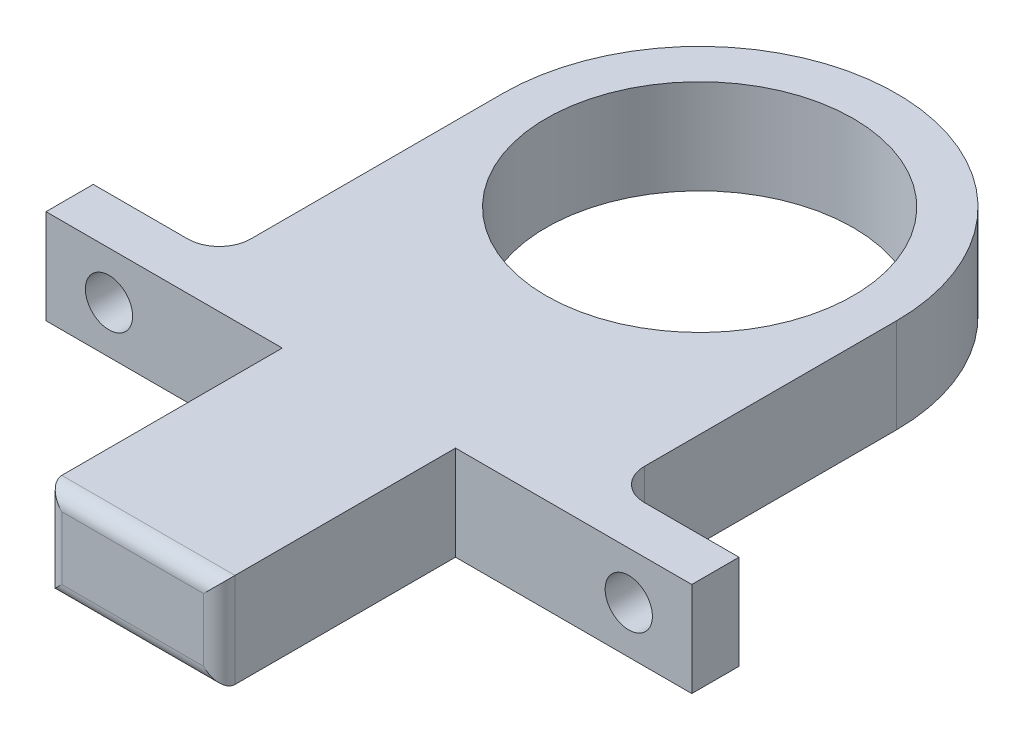
from build123d import *

# Parameters (mm, degrees)
CROQUIS1_R              = 9.75
SALIENTE_EXTRUIR1_DEPTH = 6
CROQUIS2_R              = 1.5
CORTAR_EXTRUIR1_DEPTH   = 6
CROQUIS3_R              = 3
CORTAR_EXTRUIR2_DEPTH   = 6
REDONDEO1_R             = 1


with BuildPart() as part:
    # Croquis1 → Saliente-Extruir1 (new body)
    with BuildSketch(Plane(origin=(0, 0, 0), x_dir=(1, 0, 0), z_dir=(0, 1, 0))):
        with BuildLine():
            ThreePointArc((12.5, 0), (0, 12.5), (-12.5, 0))
            Line((-12.5, 0), (-12.5, -16))
            ThreePointArc((-12.5, -16), (-13.085786438, -17.414213562), (-14.5, -18))
            Line((-14.5, -18), (-20.5, -18))
            Line((-20.5, -18), (-20.5, -21))
            Line((-20.5, -21), (-5.5, -21))
            Line((-5.5, -21), (-5.5, -36))
            Line((-5.5, -36), (5.5, -36))
            Line((5.5, -36), (5.5, -21))
            Line((5.5, -21), (20.5, -21))
            Line((20.5, -21), (20.5, -18))
            Line((20.5, -18), (14.5, -18))
            ThreePointArc((14.5, -18), (13.085786438, -17.414213562), (12.5, -16))
            Line((12.5, -16), (12.5, 0))
        make_face()
        with Locations(Location((0, 0, 0), (0, 0, 270))):
            Circle(CROQUIS1_R, mode=Mode.SUBTRACT)
    extrude(amount=SALIENTE_EXTRUIR1_DEPTH)

    # Croquis2 → Cortar-Extruir1 (cut)
    with BuildSketch(Plane.XY.offset(21)):
        with Locations((-16.5, 3)):
            Circle(CROQUIS2_R)
        with Locations((16.5, 3)):
            Circle(CROQUIS2_R)
    extrude(amount=-CORTAR_EXTRUIR1_DEPTH, mode=Mode.SUBTRACT)

    # Croquis3 → Cortar-Extruir2 (cut)
    with BuildSketch(Plane(origin=(0, 0, 18), x_dir=(-1, 0, 0), z_dir=(0, 0, -1))):
        with Locations((-16.5, 3)):
            Circle(CROQUIS3_R)
        with Locations((16.5, 3)):
            Circle(CROQUIS3_R)
    extrude(amount=CORTAR_EXTRUIR2_DEPTH, mode=Mode.SUBTRACT)

    # Redondeo1
    redondeo1_edges = [part.edges().sort_by_distance(p)[0] for p in [
        (5.5, 3, 36),
        (-5.5, 3, 36),
        (0, 6, 36),
        (0, 0, 36),
    ]]
    fillet(redondeo1_edges, radius=REDONDEO1_R)


solid = part.part
